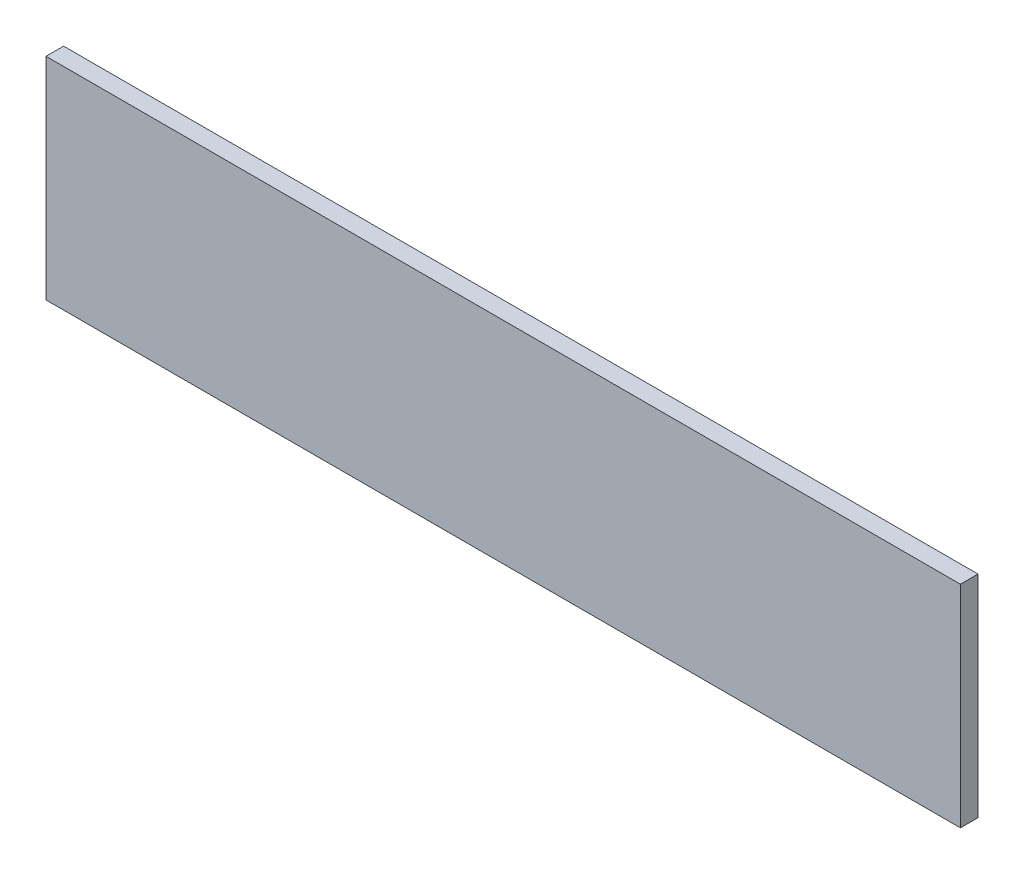
from build123d import *

# Parameters (mm, degrees)
SKETCH1_W           = 330.2
SKETCH1_H           = 76.2
BOSS_EXTRUDE1_DEPTH = 6.35


with BuildPart() as part:
    # Sketch1 → Boss-Extrude1 (new body)
    with BuildSketch(Plane.XY):
        with Locations((165.1, 38.1)):
            Rectangle(SKETCH1_W, SKETCH1_H)
    extrude(amount=BOSS_EXTRUDE1_DEPTH)


solid = part.part
